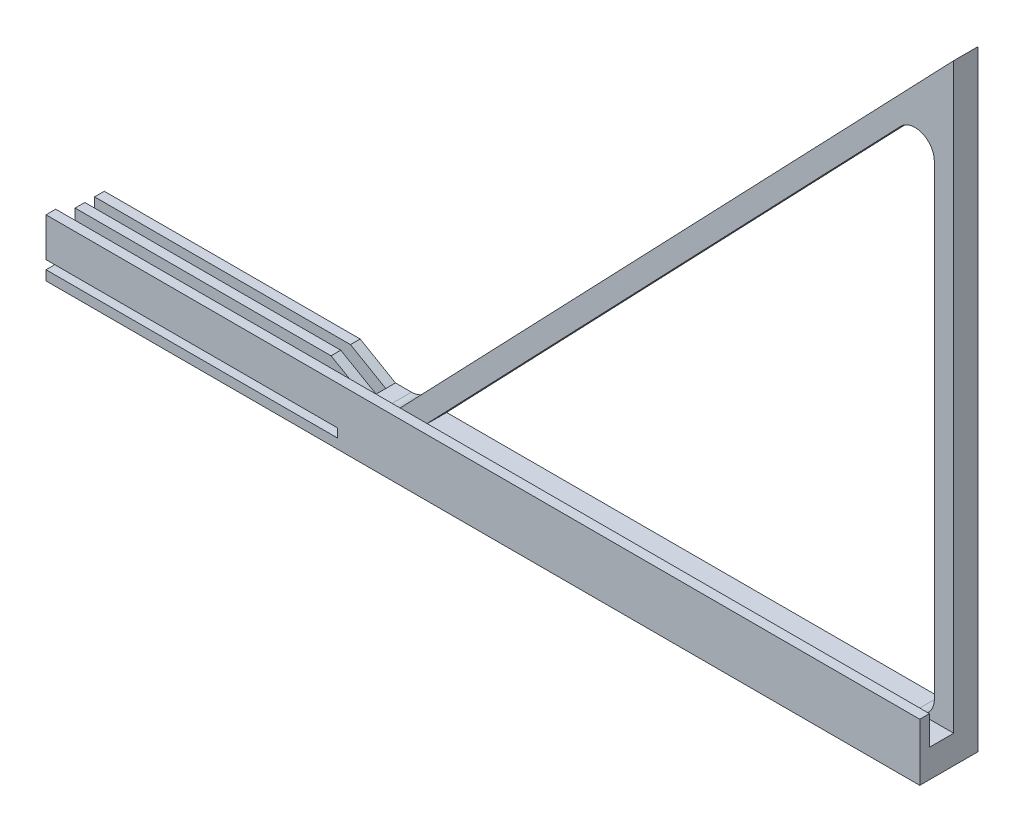
from build123d import *

# Parameters (mm, degrees)
BOSS_EXTRUDE1_DEPTH = 15.24
BOSS_EXTRUDE2_DEPTH = 6.35
SKETCH3_W           = 76.2
SKETCH3_H           = 12.7
BOSS_EXTRUDE3_DEPTH = 7.62
CUT_EXTRUDE1_DEPTH  = 76.2
CUT_EXTRUDE2_DEPTH  = 280.00035691
FILLET1_R           = 1.27
FILLET2_R           = 5.08
SKETCH6_W           = 228.6
SKETCH6_H           = 2.54
BOSS_EXTRUDE4_DEPTH = 7.62


with BuildPart() as part:
    # Sketch1 → Boss-Extrude1 (new body)
    with BuildSketch(Plane.XY):
        Polygon((0, 0), (228.6, 0), (228.6, 7.366), (0, 7.366), (0, 4.826), (76.2, 4.826), (76.2, 2.54), (0, 2.54), align=None)
    extrude(amount=BOSS_EXTRUDE1_DEPTH)

    # Sketch2 → Boss-Extrude2 (add)
    with BuildSketch(Plane.XY):
        Polygon((228.6, 7.366), (228.6, 159.766), (82.55, 7.366), (89.586126025, 7.366), (223.52, 147.123085887), (223.52, 7.366), align=None)
    extrude(amount=BOSS_EXTRUDE2_DEPTH)

    # Sketch3 → Boss-Extrude3 (add)
    with BuildSketch(Plane.XY):
        with Locations((38.1, 6.35)):
            Rectangle(SKETCH3_W, SKETCH3_H)
    extrude(amount=BOSS_EXTRUDE3_DEPTH)

    # Sketch5 → Cut-Extrude1 (cut)
    with BuildSketch(Plane.ZY):
        Polygon((7.62, 2.54), (2.54, 2.54), (2.54, 12.7), (5.08, 12.7), (5.08, 4.826), (7.62, 4.826), align=None)
    extrude(amount=-CUT_EXTRUDE1_DEPTH, mode=Mode.SUBTRACT)

    # Sketch7 → Cut-Extrude2 (cut, through all)
    with BuildSketch(Plane.XY.offset(7.62)):
        Polygon((76.2, 7.366), (66.961240992, 12.7), (76.2, 12.7), align=None)
    extrude(amount=-CUT_EXTRUDE2_DEPTH, mode=Mode.SUBTRACT)

    # Fillet1
    fillet1_edges = [part.edges().sort_by_distance(p)[0] for p in [
        (38.1, 4.826, 5.08),
        (38.1, 2.54, 2.54),
    ]]
    fillet(fillet1_edges, radius=FILLET1_R)

    # Fillet2
    fillet2_edges = [part.edges().sort_by_distance(p)[0] for p in [
        (223.52, 7.366, 3.175),
        (82.55, 7.366, 3.175),
        (223.52, 147.123085887, 3.175),
    ]]
    fillet(fillet2_edges, radius=FILLET2_R)

    # Sketch6 → Boss-Extrude4 (add)
    with BuildSketch(Plane(origin=(0, 7.366, 0), x_dir=(1, 0, 0), z_dir=(0, 1, 0))):
        with Locations((114.3, -13.97)):
            Rectangle(SKETCH6_W, SKETCH6_H)
    extrude(amount=BOSS_EXTRUDE4_DEPTH)


solid = part.part
